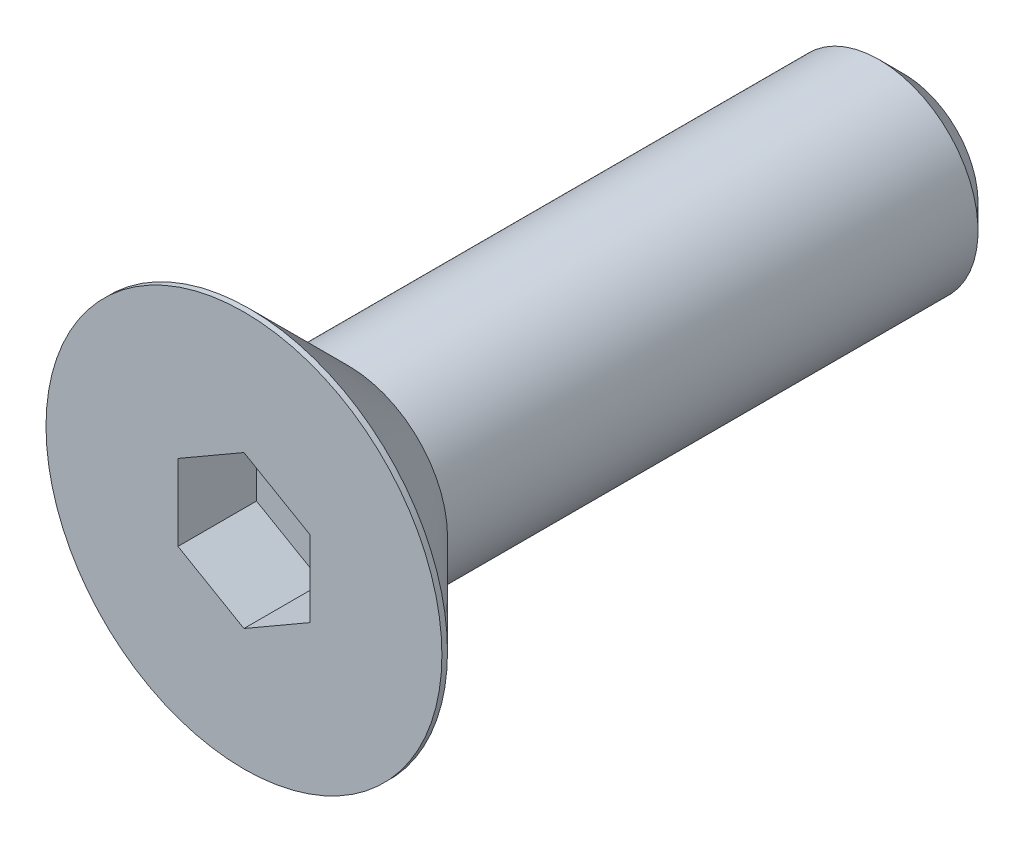
from build123d import *

# Parameters (mm, degrees)
CHAMFER1_SIZE      = 0.375
CUT_EXTRUDE2_DEPTH = 1.19


with BuildPart() as part:
    # Sketch1 → Revolve1 (revolve)
    with BuildSketch(Plane(origin=(0, 0, 0), x_dir=(0, 0, -1), z_dir=(1, 0, 0))):
        Polygon((-3.3, 1.5), (5, 1.5), (5, 0), (-3.81, 0), (-3.81, 1.5), align=None)
    revolve(axis=Axis((0, 0, 3.81), (0, 0, -1)))

    # Chamfer1
    chamfer1_edges = [part.edges().sort_by_distance(p)[0] for p in [
        (0, -1.5, -5),
    ]]
    chamfer(chamfer1_edges, length=CHAMFER1_SIZE)


with BuildPart() as body_2:
    # Sketch7 → Revolve2 (revolve)
    with BuildSketch(Plane(origin=(0, 0, 0), x_dir=(0, 0, -1), z_dir=(1, 0, 0))):
        Polygon((-4.915, 3), (-5, 3), (-5, 0), (-3.3, 0), (-3.3, 1.385), align=None)
    revolve(axis=Axis((0, 0, 5), (0, 0, -1)))

    # Sketch5 → Cut-Extrude2 (cut)
    with BuildSketch(Plane.XY.offset(5)):
        Polygon((1, -0.577350269), (1, 0.577350269), (0, 1.154700538), (-1, 0.577350269), (-1, -0.577350269), (0, -1.154700538), align=None)
    extrude(amount=-CUT_EXTRUDE2_DEPTH, mode=Mode.SUBTRACT)


solid = Compound([part.part, body_2.part])
